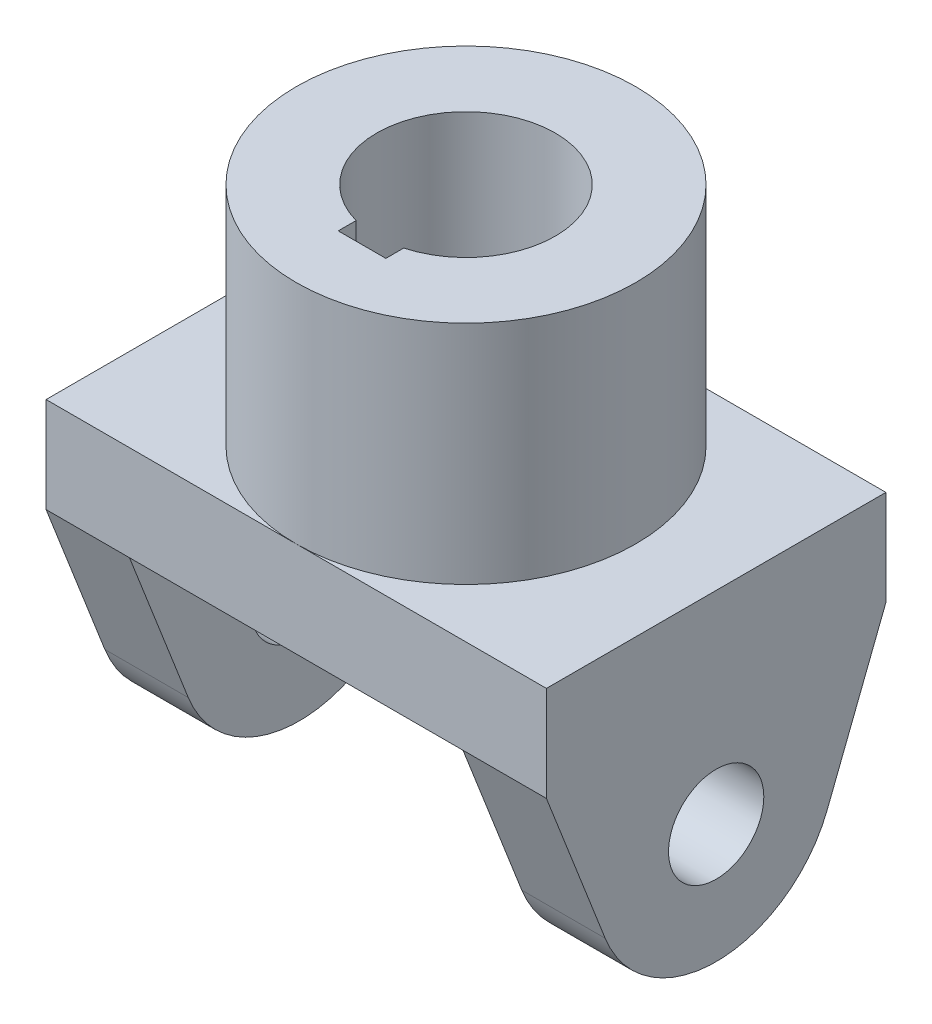
from build123d import *

# Parameters (mm, degrees)
SKETCH1_R           = 28.5
SKETCH1_R_2         = 15
BOSS_EXTRUDE1_DEPTH = 38
SKETCH2_W           = 84
SKETCH2_H           = 57
BOSS_EXTRUDE2_DEPTH = 16
SKETCH3_R           = 8
BOSS_EXTRUDE3_DEPTH = 14
CUT_EXTRUDE1_START  = -38
CUT_EXTRUDE1_DEPTH  = 38
CUT_EXTRUDE2_START  = -38
SKETCH5_R           = 15
CUT_EXTRUDE2_DEPTH  = 38


with BuildPart() as part:
    # Sketch1 → Boss-Extrude1 (new body)
    with BuildSketch(Plane(origin=(0, 0, 0), x_dir=(1, 0, 0), z_dir=(0, 1, 0))):
        with Locations(Location((0, 0, 0), (0, 0, 270))):
            Circle(SKETCH1_R)
        with Locations(Location((0, 0, 0), (0, 0, 270))):
            Circle(SKETCH1_R_2, mode=Mode.SUBTRACT)
    extrude(amount=BOSS_EXTRUDE1_DEPTH)

    # Sketch2 → Boss-Extrude2 (add)
    with BuildSketch(Plane.XZ):
        Rectangle(SKETCH2_W, SKETCH2_H)
    extrude(amount=BOSS_EXTRUDE2_DEPTH)

    # Sketch3 → Boss-Extrude3 (add)
    with BuildSketch(Plane(origin=(42, 0, 0), x_dir=(0, 0, -1), z_dir=(1, 0, 0))):
        with BuildLine():
            Line((-28.5, -16), (-18.629891095, -41.275105345))
            ThreePointArc((-18.629891095, -41.275105345), (0, -54), (18.629891095, -41.275105345))
            Line((18.629891095, -41.275105345), (28.5, -16))
            Line((28.5, -16), (-28.5, -16))
        make_face()
        with Locations((0, -34)):
            Circle(SKETCH3_R, mode=Mode.SUBTRACT)
    boss_extrude3 = extrude(amount=-BOSS_EXTRUDE3_DEPTH)

    # Mirror1: Boss-Extrude3 across plane
    add(boss_extrude3.mirror(Plane(origin=(0, 0, 0), x_dir=(0, 0, 1), z_dir=(1, 0, 0))))

    # Sketch4 → Cut-Extrude1 (cut)
    with BuildSketch(Plane(origin=(0, 38, 0), x_dir=(1, 0, 0), z_dir=(0, 1, 0)).offset(CUT_EXTRUDE1_START)):
        with BuildLine():
            Line((-4, -14.456832295), (-4, -17.456832295))
            Line((-4, -17.456832295), (4, -17.456832295))
            Line((4, -17.456832295), (4, -14.456832295))
            ThreePointArc((4, -14.456832295), (0, -15), (-4, -14.456832295))
        make_face()
    extrude(amount=CUT_EXTRUDE1_DEPTH, mode=Mode.SUBTRACT)

    # Sketch5 → Cut-Extrude2 (cut)
    with BuildSketch(Plane(origin=(0, 0, 0), x_dir=(1, 0, 0), z_dir=(0, 1, 0)).offset(CUT_EXTRUDE2_START)):
        with Locations(Location((0, 0, 0), (0, 0, 90))):
            Circle(SKETCH5_R)
    extrude(amount=CUT_EXTRUDE2_DEPTH, mode=Mode.SUBTRACT)


solid = part.part
